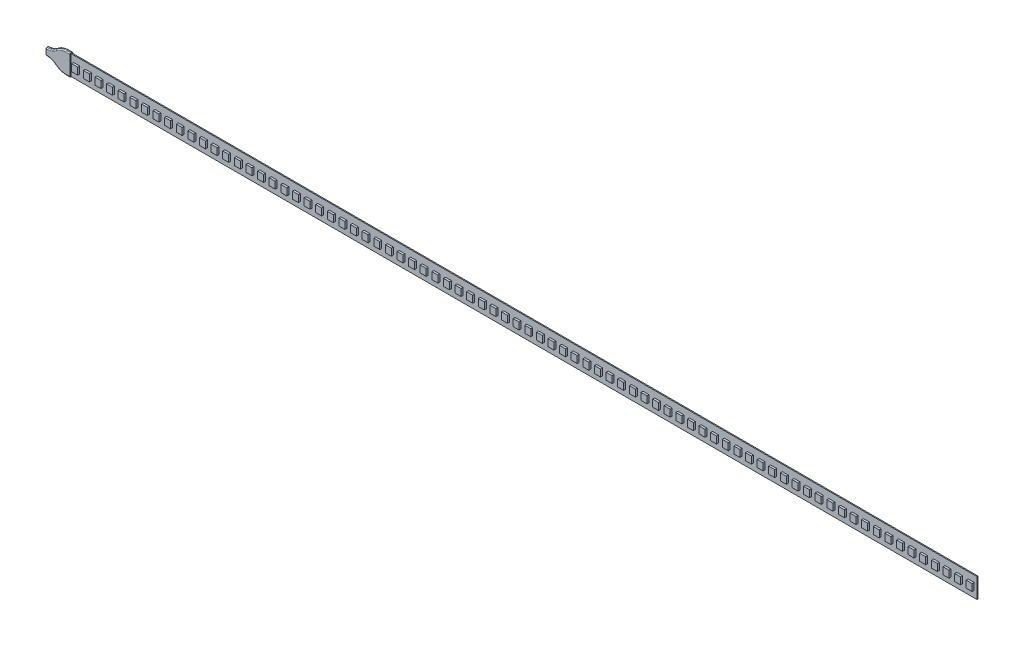
from build123d import *

# Parameters (mm, degrees)
SKETCH1_W                  = 35
SKETCH1_H                  = 10
BOSS_EXTRUDE1_DEPTH        = 0.5
SKETCH2_W                  = 3
SKETCH2_H                  = 3.5
BOSS_EXTRUDE2_DEPTH        = 1
LPATTERN1_COUNT            = 6
LPATTERN1_PITCH            = 5.833
LPATTERN2_COUNT            = 13
LPATTERN2_PITCH            = 35
LPATTERN2_COPY_1_SKETCH_W  = 3
LPATTERN2_COPY_1_SKETCH_H  = 3.5
LPATTERN2_COPY_1_DEPTH     = 1
LPATTERN2_COPY_2_SKETCH_W  = 3
LPATTERN2_COPY_2_SKETCH_H  = 3.5
LPATTERN2_COPY_2_DEPTH     = 1
LPATTERN2_COPY_3_SKETCH_W  = 3
LPATTERN2_COPY_3_SKETCH_H  = 3.5
LPATTERN2_COPY_3_DEPTH     = 1
LPATTERN2_COPY_4_SKETCH_W  = 3
LPATTERN2_COPY_4_SKETCH_H  = 3.5
LPATTERN2_COPY_4_DEPTH     = 1
LPATTERN2_COPY_5_SKETCH_W  = 3
LPATTERN2_COPY_5_SKETCH_H  = 3.5
LPATTERN2_COPY_5_DEPTH     = 1
LPATTERN2_COPY_6_SKETCH_W  = 3
LPATTERN2_COPY_6_SKETCH_H  = 3.5
LPATTERN2_COPY_6_DEPTH     = 1
LPATTERN2_COPY_7_SKETCH_W  = 3
LPATTERN2_COPY_7_SKETCH_H  = 3.5
LPATTERN2_COPY_7_DEPTH     = 1
LPATTERN2_COPY_8_SKETCH_W  = 3
LPATTERN2_COPY_8_SKETCH_H  = 3.5
LPATTERN2_COPY_8_DEPTH     = 1
LPATTERN2_COPY_9_SKETCH_W  = 3
LPATTERN2_COPY_9_SKETCH_H  = 3.5
LPATTERN2_COPY_9_DEPTH     = 1
LPATTERN2_COPY_10_SKETCH_W = 3
LPATTERN2_COPY_10_SKETCH_H = 3.5
LPATTERN2_COPY_10_DEPTH    = 1
LPATTERN2_COPY_11_SKETCH_W = 3
LPATTERN2_COPY_11_SKETCH_H = 3.5
LPATTERN2_COPY_11_DEPTH    = 1
LPATTERN2_COPY_12_SKETCH_W = 3
LPATTERN2_COPY_12_SKETCH_H = 3.5
LPATTERN2_COPY_12_DEPTH    = 1
LPATTERN2_COPY_13_SKETCH_W = 3
LPATTERN2_COPY_13_SKETCH_H = 3.5
LPATTERN2_COPY_13_DEPTH    = 1
LPATTERN2_COPY_14_SKETCH_W = 3
LPATTERN2_COPY_14_SKETCH_H = 3.5
LPATTERN2_COPY_14_DEPTH    = 1
LPATTERN2_COPY_15_SKETCH_W = 3
LPATTERN2_COPY_15_SKETCH_H = 3.5
LPATTERN2_COPY_15_DEPTH    = 1
LPATTERN2_COPY_16_SKETCH_W = 3
LPATTERN2_COPY_16_SKETCH_H = 3.5
LPATTERN2_COPY_16_DEPTH    = 1
LPATTERN2_COPY_17_SKETCH_W = 3
LPATTERN2_COPY_17_SKETCH_H = 3.5
LPATTERN2_COPY_17_DEPTH    = 1
LPATTERN2_COPY_18_SKETCH_W = 3
LPATTERN2_COPY_18_SKETCH_H = 3.5
LPATTERN2_COPY_18_DEPTH    = 1
LPATTERN2_COPY_19_SKETCH_W = 3
LPATTERN2_COPY_19_SKETCH_H = 3.5
LPATTERN2_COPY_19_DEPTH    = 1
LPATTERN2_COPY_20_SKETCH_W = 3
LPATTERN2_COPY_20_SKETCH_H = 3.5
LPATTERN2_COPY_20_DEPTH    = 1
LPATTERN2_COPY_21_SKETCH_W = 3
LPATTERN2_COPY_21_SKETCH_H = 3.5
LPATTERN2_COPY_21_DEPTH    = 1
LPATTERN2_COPY_22_SKETCH_W = 3
LPATTERN2_COPY_22_SKETCH_H = 3.5
LPATTERN2_COPY_22_DEPTH    = 1
LPATTERN2_COPY_23_SKETCH_W = 3
LPATTERN2_COPY_23_SKETCH_H = 3.5
LPATTERN2_COPY_23_DEPTH    = 1
LPATTERN2_COPY_24_SKETCH_W = 3
LPATTERN2_COPY_24_SKETCH_H = 3.5
LPATTERN2_COPY_24_DEPTH    = 1
LPATTERN2_COPY_25_SKETCH_W = 3
LPATTERN2_COPY_25_SKETCH_H = 3.5
LPATTERN2_COPY_25_DEPTH    = 1
LPATTERN2_COPY_26_SKETCH_W = 3
LPATTERN2_COPY_26_SKETCH_H = 3.5
LPATTERN2_COPY_26_DEPTH    = 1
LPATTERN2_COPY_27_SKETCH_W = 3
LPATTERN2_COPY_27_SKETCH_H = 3.5
LPATTERN2_COPY_27_DEPTH    = 1
LPATTERN2_COPY_28_SKETCH_W = 3
LPATTERN2_COPY_28_SKETCH_H = 3.5
LPATTERN2_COPY_28_DEPTH    = 1
LPATTERN2_COPY_29_SKETCH_W = 3
LPATTERN2_COPY_29_SKETCH_H = 3.5
LPATTERN2_COPY_29_DEPTH    = 1
LPATTERN2_COPY_30_SKETCH_W = 3
LPATTERN2_COPY_30_SKETCH_H = 3.5
LPATTERN2_COPY_30_DEPTH    = 1
LPATTERN2_COPY_31_SKETCH_W = 3
LPATTERN2_COPY_31_SKETCH_H = 3.5
LPATTERN2_COPY_31_DEPTH    = 1
LPATTERN2_COPY_32_SKETCH_W = 3
LPATTERN2_COPY_32_SKETCH_H = 3.5
LPATTERN2_COPY_32_DEPTH    = 1
LPATTERN2_COPY_33_SKETCH_W = 3
LPATTERN2_COPY_33_SKETCH_H = 3.5
LPATTERN2_COPY_33_DEPTH    = 1
LPATTERN2_COPY_34_SKETCH_W = 3
LPATTERN2_COPY_34_SKETCH_H = 3.5
LPATTERN2_COPY_34_DEPTH    = 1
LPATTERN2_COPY_35_SKETCH_W = 3
LPATTERN2_COPY_35_SKETCH_H = 3.5
LPATTERN2_COPY_35_DEPTH    = 1
LPATTERN2_COPY_36_SKETCH_W = 3
LPATTERN2_COPY_36_SKETCH_H = 3.5
LPATTERN2_COPY_36_DEPTH    = 1
LPATTERN2_COPY_37_SKETCH_W = 3
LPATTERN2_COPY_37_SKETCH_H = 3.5
LPATTERN2_COPY_37_DEPTH    = 1
LPATTERN2_COPY_38_SKETCH_W = 3
LPATTERN2_COPY_38_SKETCH_H = 3.5
LPATTERN2_COPY_38_DEPTH    = 1
LPATTERN2_COPY_39_SKETCH_W = 3
LPATTERN2_COPY_39_SKETCH_H = 3.5
LPATTERN2_COPY_39_DEPTH    = 1
LPATTERN2_COPY_40_SKETCH_W = 3
LPATTERN2_COPY_40_SKETCH_H = 3.5
LPATTERN2_COPY_40_DEPTH    = 1
LPATTERN2_COPY_41_SKETCH_W = 3
LPATTERN2_COPY_41_SKETCH_H = 3.5
LPATTERN2_COPY_41_DEPTH    = 1
LPATTERN2_COPY_42_SKETCH_W = 3
LPATTERN2_COPY_42_SKETCH_H = 3.5
LPATTERN2_COPY_42_DEPTH    = 1
LPATTERN2_COPY_43_SKETCH_W = 3
LPATTERN2_COPY_43_SKETCH_H = 3.5
LPATTERN2_COPY_43_DEPTH    = 1
LPATTERN2_COPY_44_SKETCH_W = 3
LPATTERN2_COPY_44_SKETCH_H = 3.5
LPATTERN2_COPY_44_DEPTH    = 1
LPATTERN2_COPY_45_SKETCH_W = 3
LPATTERN2_COPY_45_SKETCH_H = 3.5
LPATTERN2_COPY_45_DEPTH    = 1
LPATTERN2_COPY_46_SKETCH_W = 3
LPATTERN2_COPY_46_SKETCH_H = 3.5
LPATTERN2_COPY_46_DEPTH    = 1
LPATTERN2_COPY_47_SKETCH_W = 3
LPATTERN2_COPY_47_SKETCH_H = 3.5
LPATTERN2_COPY_47_DEPTH    = 1
LPATTERN2_COPY_48_SKETCH_W = 3
LPATTERN2_COPY_48_SKETCH_H = 3.5
LPATTERN2_COPY_48_DEPTH    = 1
LPATTERN2_COPY_49_SKETCH_W = 3
LPATTERN2_COPY_49_SKETCH_H = 3.5
LPATTERN2_COPY_49_DEPTH    = 1
LPATTERN2_COPY_50_SKETCH_W = 3
LPATTERN2_COPY_50_SKETCH_H = 3.5
LPATTERN2_COPY_50_DEPTH    = 1
LPATTERN2_COPY_51_SKETCH_W = 3
LPATTERN2_COPY_51_SKETCH_H = 3.5
LPATTERN2_COPY_51_DEPTH    = 1
LPATTERN2_COPY_52_SKETCH_W = 3
LPATTERN2_COPY_52_SKETCH_H = 3.5
LPATTERN2_COPY_52_DEPTH    = 1
LPATTERN2_COPY_53_SKETCH_W = 3
LPATTERN2_COPY_53_SKETCH_H = 3.5
LPATTERN2_COPY_53_DEPTH    = 1
LPATTERN2_COPY_54_SKETCH_W = 3
LPATTERN2_COPY_54_SKETCH_H = 3.5
LPATTERN2_COPY_54_DEPTH    = 1
LPATTERN2_COPY_55_SKETCH_W = 3
LPATTERN2_COPY_55_SKETCH_H = 3.5
LPATTERN2_COPY_55_DEPTH    = 1
LPATTERN2_COPY_56_SKETCH_W = 3
LPATTERN2_COPY_56_SKETCH_H = 3.5
LPATTERN2_COPY_56_DEPTH    = 1
LPATTERN2_COPY_57_SKETCH_W = 3
LPATTERN2_COPY_57_SKETCH_H = 3.5
LPATTERN2_COPY_57_DEPTH    = 1
LPATTERN2_COPY_58_SKETCH_W = 3
LPATTERN2_COPY_58_SKETCH_H = 3.5
LPATTERN2_COPY_58_DEPTH    = 1
LPATTERN2_COPY_59_SKETCH_W = 3
LPATTERN2_COPY_59_SKETCH_H = 3.5
LPATTERN2_COPY_59_DEPTH    = 1
LPATTERN2_COPY_60_SKETCH_W = 3
LPATTERN2_COPY_60_SKETCH_H = 3.5
LPATTERN2_COPY_60_DEPTH    = 1
BOSS_EXTRUDE3_DEPTH        = 1
BOSS_EXTRUDE3_DEPTH_BACK   = 0.5
FILLET1_R                  = 0.5


with BuildPart() as part:
    # Sketch1 → Boss-Extrude1 (new body)
    with BuildSketch(Plane.XY):
        Rectangle(SKETCH1_W, SKETCH1_H)
    boss_extrude1 = extrude(amount=BOSS_EXTRUDE1_DEPTH)

    # Sketch2 → Boss-Extrude2 (add)
    with BuildSketch(Plane.XY.offset(0.5)):
        with Locations((-14.5835, 0)):
            Rectangle(SKETCH2_W, SKETCH2_H)
    boss_extrude2 = extrude(amount=BOSS_EXTRUDE2_DEPTH)

    # LPattern1: Boss-Extrude2 ×6
    with Locations(*[(i * LPATTERN1_PITCH, 0, 0) for i in range(1, LPATTERN1_COUNT)]):
        add(boss_extrude2)

    # LPattern2: Boss-Extrude1, Boss-Extrude2 ×13
    with Locations(*[(i * LPATTERN2_PITCH, 0, 0) for i in range(1, LPATTERN2_COUNT)]):
        add(boss_extrude1)
        add(boss_extrude2)

    # LPattern2 copy 1 sketch → LPattern2 copy 1 (add)
    with BuildSketch(Plane(origin=(40.833, 0, 0.5), x_dir=(1, 0, 0), z_dir=(0, 0, 1))):
        with Locations((-14.5835, 0)):
            Rectangle(LPATTERN2_COPY_1_SKETCH_W, LPATTERN2_COPY_1_SKETCH_H)
    extrude(amount=LPATTERN2_COPY_1_DEPTH)

    # LPattern2 copy 2 sketch → LPattern2 copy 2 (add)
    with BuildSketch(Plane(origin=(75.833, 0, 0.5), x_dir=(1, 0, 0), z_dir=(0, 0, 1))):
        with Locations((-14.5835, 0)):
            Rectangle(LPATTERN2_COPY_2_SKETCH_W, LPATTERN2_COPY_2_SKETCH_H)
    extrude(amount=LPATTERN2_COPY_2_DEPTH)

    # LPattern2 copy 3 sketch → LPattern2 copy 3 (add)
    with BuildSketch(Plane(origin=(110.833, 0, 0.5), x_dir=(1, 0, 0), z_dir=(0, 0, 1))):
        with Locations((-14.5835, 0)):
            Rectangle(LPATTERN2_COPY_3_SKETCH_W, LPATTERN2_COPY_3_SKETCH_H)
    extrude(amount=LPATTERN2_COPY_3_DEPTH)

    # LPattern2 copy 4 sketch → LPattern2 copy 4 (add)
    with BuildSketch(Plane(origin=(145.833, 0, 0.5), x_dir=(1, 0, 0), z_dir=(0, 0, 1))):
        with Locations((-14.5835, 0)):
            Rectangle(LPATTERN2_COPY_4_SKETCH_W, LPATTERN2_COPY_4_SKETCH_H)
    extrude(amount=LPATTERN2_COPY_4_DEPTH)

    # LPattern2 copy 5 sketch → LPattern2 copy 5 (add)
    with BuildSketch(Plane(origin=(180.833, 0, 0.5), x_dir=(1, 0, 0), z_dir=(0, 0, 1))):
        with Locations((-14.5835, 0)):
            Rectangle(LPATTERN2_COPY_5_SKETCH_W, LPATTERN2_COPY_5_SKETCH_H)
    extrude(amount=LPATTERN2_COPY_5_DEPTH)

    # LPattern2 copy 6 sketch → LPattern2 copy 6 (add)
    with BuildSketch(Plane(origin=(215.833, 0, 0.5), x_dir=(1, 0, 0), z_dir=(0, 0, 1))):
        with Locations((-14.5835, 0)):
            Rectangle(LPATTERN2_COPY_6_SKETCH_W, LPATTERN2_COPY_6_SKETCH_H)
    extrude(amount=LPATTERN2_COPY_6_DEPTH)

    # LPattern2 copy 7 sketch → LPattern2 copy 7 (add)
    with BuildSketch(Plane(origin=(250.833, 0, 0.5), x_dir=(1, 0, 0), z_dir=(0, 0, 1))):
        with Locations((-14.5835, 0)):
            Rectangle(LPATTERN2_COPY_7_SKETCH_W, LPATTERN2_COPY_7_SKETCH_H)
    extrude(amount=LPATTERN2_COPY_7_DEPTH)

    # LPattern2 copy 8 sketch → LPattern2 copy 8 (add)
    with BuildSketch(Plane(origin=(285.833, 0, 0.5), x_dir=(1, 0, 0), z_dir=(0, 0, 1))):
        with Locations((-14.5835, 0)):
            Rectangle(LPATTERN2_COPY_8_SKETCH_W, LPATTERN2_COPY_8_SKETCH_H)
    extrude(amount=LPATTERN2_COPY_8_DEPTH)

    # LPattern2 copy 9 sketch → LPattern2 copy 9 (add)
    with BuildSketch(Plane(origin=(320.833, 0, 0.5), x_dir=(1, 0, 0), z_dir=(0, 0, 1))):
        with Locations((-14.5835, 0)):
            Rectangle(LPATTERN2_COPY_9_SKETCH_W, LPATTERN2_COPY_9_SKETCH_H)
    extrude(amount=LPATTERN2_COPY_9_DEPTH)

    # LPattern2 copy 10 sketch → LPattern2 copy 10 (add)
    with BuildSketch(Plane(origin=(355.833, 0, 0.5), x_dir=(1, 0, 0), z_dir=(0, 0, 1))):
        with Locations((-14.5835, 0)):
            Rectangle(LPATTERN2_COPY_10_SKETCH_W, LPATTERN2_COPY_10_SKETCH_H)
    extrude(amount=LPATTERN2_COPY_10_DEPTH)

    # LPattern2 copy 11 sketch → LPattern2 copy 11 (add)
    with BuildSketch(Plane(origin=(390.833, 0, 0.5), x_dir=(1, 0, 0), z_dir=(0, 0, 1))):
        with Locations((-14.5835, 0)):
            Rectangle(LPATTERN2_COPY_11_SKETCH_W, LPATTERN2_COPY_11_SKETCH_H)
    extrude(amount=LPATTERN2_COPY_11_DEPTH)

    # LPattern2 copy 12 sketch → LPattern2 copy 12 (add)
    with BuildSketch(Plane(origin=(425.833, 0, 0.5), x_dir=(1, 0, 0), z_dir=(0, 0, 1))):
        with Locations((-14.5835, 0)):
            Rectangle(LPATTERN2_COPY_12_SKETCH_W, LPATTERN2_COPY_12_SKETCH_H)
    extrude(amount=LPATTERN2_COPY_12_DEPTH)

    # LPattern2 copy 13 sketch → LPattern2 copy 13 (add)
    with BuildSketch(Plane(origin=(46.666, 0, 0.5), x_dir=(1, 0, 0), z_dir=(0, 0, 1))):
        with Locations((-14.5835, 0)):
            Rectangle(LPATTERN2_COPY_13_SKETCH_W, LPATTERN2_COPY_13_SKETCH_H)
    extrude(amount=LPATTERN2_COPY_13_DEPTH)

    # LPattern2 copy 14 sketch → LPattern2 copy 14 (add)
    with BuildSketch(Plane(origin=(81.666, 0, 0.5), x_dir=(1, 0, 0), z_dir=(0, 0, 1))):
        with Locations((-14.5835, 0)):
            Rectangle(LPATTERN2_COPY_14_SKETCH_W, LPATTERN2_COPY_14_SKETCH_H)
    extrude(amount=LPATTERN2_COPY_14_DEPTH)

    # LPattern2 copy 15 sketch → LPattern2 copy 15 (add)
    with BuildSketch(Plane(origin=(116.666, 0, 0.5), x_dir=(1, 0, 0), z_dir=(0, 0, 1))):
        with Locations((-14.5835, 0)):
            Rectangle(LPATTERN2_COPY_15_SKETCH_W, LPATTERN2_COPY_15_SKETCH_H)
    extrude(amount=LPATTERN2_COPY_15_DEPTH)

    # LPattern2 copy 16 sketch → LPattern2 copy 16 (add)
    with BuildSketch(Plane(origin=(151.666, 0, 0.5), x_dir=(1, 0, 0), z_dir=(0, 0, 1))):
        with Locations((-14.5835, 0)):
            Rectangle(LPATTERN2_COPY_16_SKETCH_W, LPATTERN2_COPY_16_SKETCH_H)
    extrude(amount=LPATTERN2_COPY_16_DEPTH)

    # LPattern2 copy 17 sketch → LPattern2 copy 17 (add)
    with BuildSketch(Plane(origin=(186.666, 0, 0.5), x_dir=(1, 0, 0), z_dir=(0, 0, 1))):
        with Locations((-14.5835, 0)):
            Rectangle(LPATTERN2_COPY_17_SKETCH_W, LPATTERN2_COPY_17_SKETCH_H)
    extrude(amount=LPATTERN2_COPY_17_DEPTH)

    # LPattern2 copy 18 sketch → LPattern2 copy 18 (add)
    with BuildSketch(Plane(origin=(221.666, 0, 0.5), x_dir=(1, 0, 0), z_dir=(0, 0, 1))):
        with Locations((-14.5835, 0)):
            Rectangle(LPATTERN2_COPY_18_SKETCH_W, LPATTERN2_COPY_18_SKETCH_H)
    extrude(amount=LPATTERN2_COPY_18_DEPTH)

    # LPattern2 copy 19 sketch → LPattern2 copy 19 (add)
    with BuildSketch(Plane(origin=(256.666, 0, 0.5), x_dir=(1, 0, 0), z_dir=(0, 0, 1))):
        with Locations((-14.5835, 0)):
            Rectangle(LPATTERN2_COPY_19_SKETCH_W, LPATTERN2_COPY_19_SKETCH_H)
    extrude(amount=LPATTERN2_COPY_19_DEPTH)

    # LPattern2 copy 20 sketch → LPattern2 copy 20 (add)
    with BuildSketch(Plane(origin=(291.666, 0, 0.5), x_dir=(1, 0, 0), z_dir=(0, 0, 1))):
        with Locations((-14.5835, 0)):
            Rectangle(LPATTERN2_COPY_20_SKETCH_W, LPATTERN2_COPY_20_SKETCH_H)
    extrude(amount=LPATTERN2_COPY_20_DEPTH)

    # LPattern2 copy 21 sketch → LPattern2 copy 21 (add)
    with BuildSketch(Plane(origin=(326.666, 0, 0.5), x_dir=(1, 0, 0), z_dir=(0, 0, 1))):
        with Locations((-14.5835, 0)):
            Rectangle(LPATTERN2_COPY_21_SKETCH_W, LPATTERN2_COPY_21_SKETCH_H)
    extrude(amount=LPATTERN2_COPY_21_DEPTH)

    # LPattern2 copy 22 sketch → LPattern2 copy 22 (add)
    with BuildSketch(Plane(origin=(361.666, 0, 0.5), x_dir=(1, 0, 0), z_dir=(0, 0, 1))):
        with Locations((-14.5835, 0)):
            Rectangle(LPATTERN2_COPY_22_SKETCH_W, LPATTERN2_COPY_22_SKETCH_H)
    extrude(amount=LPATTERN2_COPY_22_DEPTH)

    # LPattern2 copy 23 sketch → LPattern2 copy 23 (add)
    with BuildSketch(Plane(origin=(396.666, 0, 0.5), x_dir=(1, 0, 0), z_dir=(0, 0, 1))):
        with Locations((-14.5835, 0)):
            Rectangle(LPATTERN2_COPY_23_SKETCH_W, LPATTERN2_COPY_23_SKETCH_H)
    extrude(amount=LPATTERN2_COPY_23_DEPTH)

    # LPattern2 copy 24 sketch → LPattern2 copy 24 (add)
    with BuildSketch(Plane(origin=(431.666, 0, 0.5), x_dir=(1, 0, 0), z_dir=(0, 0, 1))):
        with Locations((-14.5835, 0)):
            Rectangle(LPATTERN2_COPY_24_SKETCH_W, LPATTERN2_COPY_24_SKETCH_H)
    extrude(amount=LPATTERN2_COPY_24_DEPTH)

    # LPattern2 copy 25 sketch → LPattern2 copy 25 (add)
    with BuildSketch(Plane(origin=(52.499, 0, 0.5), x_dir=(1, 0, 0), z_dir=(0, 0, 1))):
        with Locations((-14.5835, 0)):
            Rectangle(LPATTERN2_COPY_25_SKETCH_W, LPATTERN2_COPY_25_SKETCH_H)
    extrude(amount=LPATTERN2_COPY_25_DEPTH)

    # LPattern2 copy 26 sketch → LPattern2 copy 26 (add)
    with BuildSketch(Plane(origin=(87.499, 0, 0.5), x_dir=(1, 0, 0), z_dir=(0, 0, 1))):
        with Locations((-14.5835, 0)):
            Rectangle(LPATTERN2_COPY_26_SKETCH_W, LPATTERN2_COPY_26_SKETCH_H)
    extrude(amount=LPATTERN2_COPY_26_DEPTH)

    # LPattern2 copy 27 sketch → LPattern2 copy 27 (add)
    with BuildSketch(Plane(origin=(122.499, 0, 0.5), x_dir=(1, 0, 0), z_dir=(0, 0, 1))):
        with Locations((-14.5835, 0)):
            Rectangle(LPATTERN2_COPY_27_SKETCH_W, LPATTERN2_COPY_27_SKETCH_H)
    extrude(amount=LPATTERN2_COPY_27_DEPTH)

    # LPattern2 copy 28 sketch → LPattern2 copy 28 (add)
    with BuildSketch(Plane(origin=(157.499, 0, 0.5), x_dir=(1, 0, 0), z_dir=(0, 0, 1))):
        with Locations((-14.5835, 0)):
            Rectangle(LPATTERN2_COPY_28_SKETCH_W, LPATTERN2_COPY_28_SKETCH_H)
    extrude(amount=LPATTERN2_COPY_28_DEPTH)

    # LPattern2 copy 29 sketch → LPattern2 copy 29 (add)
    with BuildSketch(Plane(origin=(192.499, 0, 0.5), x_dir=(1, 0, 0), z_dir=(0, 0, 1))):
        with Locations((-14.5835, 0)):
            Rectangle(LPATTERN2_COPY_29_SKETCH_W, LPATTERN2_COPY_29_SKETCH_H)
    extrude(amount=LPATTERN2_COPY_29_DEPTH)

    # LPattern2 copy 30 sketch → LPattern2 copy 30 (add)
    with BuildSketch(Plane(origin=(227.499, 0, 0.5), x_dir=(1, 0, 0), z_dir=(0, 0, 1))):
        with Locations((-14.5835, 0)):
            Rectangle(LPATTERN2_COPY_30_SKETCH_W, LPATTERN2_COPY_30_SKETCH_H)
    extrude(amount=LPATTERN2_COPY_30_DEPTH)

    # LPattern2 copy 31 sketch → LPattern2 copy 31 (add)
    with BuildSketch(Plane(origin=(262.499, 0, 0.5), x_dir=(1, 0, 0), z_dir=(0, 0, 1))):
        with Locations((-14.5835, 0)):
            Rectangle(LPATTERN2_COPY_31_SKETCH_W, LPATTERN2_COPY_31_SKETCH_H)
    extrude(amount=LPATTERN2_COPY_31_DEPTH)

    # LPattern2 copy 32 sketch → LPattern2 copy 32 (add)
    with BuildSketch(Plane(origin=(297.499, 0, 0.5), x_dir=(1, 0, 0), z_dir=(0, 0, 1))):
        with Locations((-14.5835, 0)):
            Rectangle(LPATTERN2_COPY_32_SKETCH_W, LPATTERN2_COPY_32_SKETCH_H)
    extrude(amount=LPATTERN2_COPY_32_DEPTH)

    # LPattern2 copy 33 sketch → LPattern2 copy 33 (add)
    with BuildSketch(Plane(origin=(332.499, 0, 0.5), x_dir=(1, 0, 0), z_dir=(0, 0, 1))):
        with Locations((-14.5835, 0)):
            Rectangle(LPATTERN2_COPY_33_SKETCH_W, LPATTERN2_COPY_33_SKETCH_H)
    extrude(amount=LPATTERN2_COPY_33_DEPTH)

    # LPattern2 copy 34 sketch → LPattern2 copy 34 (add)
    with BuildSketch(Plane(origin=(367.499, 0, 0.5), x_dir=(1, 0, 0), z_dir=(0, 0, 1))):
        with Locations((-14.5835, 0)):
            Rectangle(LPATTERN2_COPY_34_SKETCH_W, LPATTERN2_COPY_34_SKETCH_H)
    extrude(amount=LPATTERN2_COPY_34_DEPTH)

    # LPattern2 copy 35 sketch → LPattern2 copy 35 (add)
    with BuildSketch(Plane(origin=(402.499, 0, 0.5), x_dir=(1, 0, 0), z_dir=(0, 0, 1))):
        with Locations((-14.5835, 0)):
            Rectangle(LPATTERN2_COPY_35_SKETCH_W, LPATTERN2_COPY_35_SKETCH_H)
    extrude(amount=LPATTERN2_COPY_35_DEPTH)

    # LPattern2 copy 36 sketch → LPattern2 copy 36 (add)
    with BuildSketch(Plane(origin=(437.499, 0, 0.5), x_dir=(1, 0, 0), z_dir=(0, 0, 1))):
        with Locations((-14.5835, 0)):
            Rectangle(LPATTERN2_COPY_36_SKETCH_W, LPATTERN2_COPY_36_SKETCH_H)
    extrude(amount=LPATTERN2_COPY_36_DEPTH)

    # LPattern2 copy 37 sketch → LPattern2 copy 37 (add)
    with BuildSketch(Plane(origin=(58.332, 0, 0.5), x_dir=(1, 0, 0), z_dir=(0, 0, 1))):
        with Locations((-14.5835, 0)):
            Rectangle(LPATTERN2_COPY_37_SKETCH_W, LPATTERN2_COPY_37_SKETCH_H)
    extrude(amount=LPATTERN2_COPY_37_DEPTH)

    # LPattern2 copy 38 sketch → LPattern2 copy 38 (add)
    with BuildSketch(Plane(origin=(93.332, 0, 0.5), x_dir=(1, 0, 0), z_dir=(0, 0, 1))):
        with Locations((-14.5835, 0)):
            Rectangle(LPATTERN2_COPY_38_SKETCH_W, LPATTERN2_COPY_38_SKETCH_H)
    extrude(amount=LPATTERN2_COPY_38_DEPTH)

    # LPattern2 copy 39 sketch → LPattern2 copy 39 (add)
    with BuildSketch(Plane(origin=(128.332, 0, 0.5), x_dir=(1, 0, 0), z_dir=(0, 0, 1))):
        with Locations((-14.5835, 0)):
            Rectangle(LPATTERN2_COPY_39_SKETCH_W, LPATTERN2_COPY_39_SKETCH_H)
    extrude(amount=LPATTERN2_COPY_39_DEPTH)

    # LPattern2 copy 40 sketch → LPattern2 copy 40 (add)
    with BuildSketch(Plane(origin=(163.332, 0, 0.5), x_dir=(1, 0, 0), z_dir=(0, 0, 1))):
        with Locations((-14.5835, 0)):
            Rectangle(LPATTERN2_COPY_40_SKETCH_W, LPATTERN2_COPY_40_SKETCH_H)
    extrude(amount=LPATTERN2_COPY_40_DEPTH)

    # LPattern2 copy 41 sketch → LPattern2 copy 41 (add)
    with BuildSketch(Plane(origin=(198.332, 0, 0.5), x_dir=(1, 0, 0), z_dir=(0, 0, 1))):
        with Locations((-14.5835, 0)):
            Rectangle(LPATTERN2_COPY_41_SKETCH_W, LPATTERN2_COPY_41_SKETCH_H)
    extrude(amount=LPATTERN2_COPY_41_DEPTH)

    # LPattern2 copy 42 sketch → LPattern2 copy 42 (add)
    with BuildSketch(Plane(origin=(233.332, 0, 0.5), x_dir=(1, 0, 0), z_dir=(0, 0, 1))):
        with Locations((-14.5835, 0)):
            Rectangle(LPATTERN2_COPY_42_SKETCH_W, LPATTERN2_COPY_42_SKETCH_H)
    extrude(amount=LPATTERN2_COPY_42_DEPTH)

    # LPattern2 copy 43 sketch → LPattern2 copy 43 (add)
    with BuildSketch(Plane(origin=(268.332, 0, 0.5), x_dir=(1, 0, 0), z_dir=(0, 0, 1))):
        with Locations((-14.5835, 0)):
            Rectangle(LPATTERN2_COPY_43_SKETCH_W, LPATTERN2_COPY_43_SKETCH_H)
    extrude(amount=LPATTERN2_COPY_43_DEPTH)

    # LPattern2 copy 44 sketch → LPattern2 copy 44 (add)
    with BuildSketch(Plane(origin=(303.332, 0, 0.5), x_dir=(1, 0, 0), z_dir=(0, 0, 1))):
        with Locations((-14.5835, 0)):
            Rectangle(LPATTERN2_COPY_44_SKETCH_W, LPATTERN2_COPY_44_SKETCH_H)
    extrude(amount=LPATTERN2_COPY_44_DEPTH)

    # LPattern2 copy 45 sketch → LPattern2 copy 45 (add)
    with BuildSketch(Plane(origin=(338.332, 0, 0.5), x_dir=(1, 0, 0), z_dir=(0, 0, 1))):
        with Locations((-14.5835, 0)):
            Rectangle(LPATTERN2_COPY_45_SKETCH_W, LPATTERN2_COPY_45_SKETCH_H)
    extrude(amount=LPATTERN2_COPY_45_DEPTH)

    # LPattern2 copy 46 sketch → LPattern2 copy 46 (add)
    with BuildSketch(Plane(origin=(373.332, 0, 0.5), x_dir=(1, 0, 0), z_dir=(0, 0, 1))):
        with Locations((-14.5835, 0)):
            Rectangle(LPATTERN2_COPY_46_SKETCH_W, LPATTERN2_COPY_46_SKETCH_H)
    extrude(amount=LPATTERN2_COPY_46_DEPTH)

    # LPattern2 copy 47 sketch → LPattern2 copy 47 (add)
    with BuildSketch(Plane(origin=(408.332, 0, 0.5), x_dir=(1, 0, 0), z_dir=(0, 0, 1))):
        with Locations((-14.5835, 0)):
            Rectangle(LPATTERN2_COPY_47_SKETCH_W, LPATTERN2_COPY_47_SKETCH_H)
    extrude(amount=LPATTERN2_COPY_47_DEPTH)

    # LPattern2 copy 48 sketch → LPattern2 copy 48 (add)
    with BuildSketch(Plane(origin=(443.332, 0, 0.5), x_dir=(1, 0, 0), z_dir=(0, 0, 1))):
        with Locations((-14.5835, 0)):
            Rectangle(LPATTERN2_COPY_48_SKETCH_W, LPATTERN2_COPY_48_SKETCH_H)
    extrude(amount=LPATTERN2_COPY_48_DEPTH)

    # LPattern2 copy 49 sketch → LPattern2 copy 49 (add)
    with BuildSketch(Plane(origin=(64.165, 0, 0.5), x_dir=(1, 0, 0), z_dir=(0, 0, 1))):
        with Locations((-14.5835, 0)):
            Rectangle(LPATTERN2_COPY_49_SKETCH_W, LPATTERN2_COPY_49_SKETCH_H)
    extrude(amount=LPATTERN2_COPY_49_DEPTH)

    # LPattern2 copy 50 sketch → LPattern2 copy 50 (add)
    with BuildSketch(Plane(origin=(99.165, 0, 0.5), x_dir=(1, 0, 0), z_dir=(0, 0, 1))):
        with Locations((-14.5835, 0)):
            Rectangle(LPATTERN2_COPY_50_SKETCH_W, LPATTERN2_COPY_50_SKETCH_H)
    extrude(amount=LPATTERN2_COPY_50_DEPTH)

    # LPattern2 copy 51 sketch → LPattern2 copy 51 (add)
    with BuildSketch(Plane(origin=(134.165, 0, 0.5), x_dir=(1, 0, 0), z_dir=(0, 0, 1))):
        with Locations((-14.5835, 0)):
            Rectangle(LPATTERN2_COPY_51_SKETCH_W, LPATTERN2_COPY_51_SKETCH_H)
    extrude(amount=LPATTERN2_COPY_51_DEPTH)

    # LPattern2 copy 52 sketch → LPattern2 copy 52 (add)
    with BuildSketch(Plane(origin=(169.165, 0, 0.5), x_dir=(1, 0, 0), z_dir=(0, 0, 1))):
        with Locations((-14.5835, 0)):
            Rectangle(LPATTERN2_COPY_52_SKETCH_W, LPATTERN2_COPY_52_SKETCH_H)
    extrude(amount=LPATTERN2_COPY_52_DEPTH)

    # LPattern2 copy 53 sketch → LPattern2 copy 53 (add)
    with BuildSketch(Plane(origin=(204.165, 0, 0.5), x_dir=(1, 0, 0), z_dir=(0, 0, 1))):
        with Locations((-14.5835, 0)):
            Rectangle(LPATTERN2_COPY_53_SKETCH_W, LPATTERN2_COPY_53_SKETCH_H)
    extrude(amount=LPATTERN2_COPY_53_DEPTH)

    # LPattern2 copy 54 sketch → LPattern2 copy 54 (add)
    with BuildSketch(Plane(origin=(239.165, 0, 0.5), x_dir=(1, 0, 0), z_dir=(0, 0, 1))):
        with Locations((-14.5835, 0)):
            Rectangle(LPATTERN2_COPY_54_SKETCH_W, LPATTERN2_COPY_54_SKETCH_H)
    extrude(amount=LPATTERN2_COPY_54_DEPTH)

    # LPattern2 copy 55 sketch → LPattern2 copy 55 (add)
    with BuildSketch(Plane(origin=(274.165, 0, 0.5), x_dir=(1, 0, 0), z_dir=(0, 0, 1))):
        with Locations((-14.5835, 0)):
            Rectangle(LPATTERN2_COPY_55_SKETCH_W, LPATTERN2_COPY_55_SKETCH_H)
    extrude(amount=LPATTERN2_COPY_55_DEPTH)

    # LPattern2 copy 56 sketch → LPattern2 copy 56 (add)
    with BuildSketch(Plane(origin=(309.165, 0, 0.5), x_dir=(1, 0, 0), z_dir=(0, 0, 1))):
        with Locations((-14.5835, 0)):
            Rectangle(LPATTERN2_COPY_56_SKETCH_W, LPATTERN2_COPY_56_SKETCH_H)
    extrude(amount=LPATTERN2_COPY_56_DEPTH)

    # LPattern2 copy 57 sketch → LPattern2 copy 57 (add)
    with BuildSketch(Plane(origin=(344.165, 0, 0.5), x_dir=(1, 0, 0), z_dir=(0, 0, 1))):
        with Locations((-14.5835, 0)):
            Rectangle(LPATTERN2_COPY_57_SKETCH_W, LPATTERN2_COPY_57_SKETCH_H)
    extrude(amount=LPATTERN2_COPY_57_DEPTH)

    # LPattern2 copy 58 sketch → LPattern2 copy 58 (add)
    with BuildSketch(Plane(origin=(379.165, 0, 0.5), x_dir=(1, 0, 0), z_dir=(0, 0, 1))):
        with Locations((-14.5835, 0)):
            Rectangle(LPATTERN2_COPY_58_SKETCH_W, LPATTERN2_COPY_58_SKETCH_H)
    extrude(amount=LPATTERN2_COPY_58_DEPTH)

    # LPattern2 copy 59 sketch → LPattern2 copy 59 (add)
    with BuildSketch(Plane(origin=(414.165, 0, 0.5), x_dir=(1, 0, 0), z_dir=(0, 0, 1))):
        with Locations((-14.5835, 0)):
            Rectangle(LPATTERN2_COPY_59_SKETCH_W, LPATTERN2_COPY_59_SKETCH_H)
    extrude(amount=LPATTERN2_COPY_59_DEPTH)

    # LPattern2 copy 60 sketch → LPattern2 copy 60 (add)
    with BuildSketch(Plane(origin=(449.165, 0, 0.5), x_dir=(1, 0, 0), z_dir=(0, 0, 1))):
        with Locations((-14.5835, 0)):
            Rectangle(LPATTERN2_COPY_60_SKETCH_W, LPATTERN2_COPY_60_SKETCH_H)
    extrude(amount=LPATTERN2_COPY_60_DEPTH)

    # Sketch3 → Boss-Extrude3 (add, two sides: drawn at the far end of the back side and taken through both)
    with BuildSketch(Plane.XY.offset(-BOSS_EXTRUDE3_DEPTH_BACK)):
        with BuildLine():
            Line((-17.5, 5.25), (-17.5, -5.25))
            Line((-17.5, -5.25), (-19.5, -5.25))
            ThreePointArc((-19.5, -5.25), (-22.148702513, -4.799864322), (-24.5, -3.5))
            ThreePointArc((-24.5, -3.5), (-26.851297487, -2.200135678), (-29.5, -1.75))
            Line((-29.5, -1.75), (-29.5, 1.75))
            ThreePointArc((-29.5, 1.75), (-26.851297487, 2.200135678), (-24.5, 3.5))
            ThreePointArc((-24.5, 3.5), (-22.148702513, 4.799864322), (-19.5, 5.25))
            Line((-19.5, 5.25), (-17.5, 5.25))
        make_face()
    extrude(amount=BOSS_EXTRUDE3_DEPTH + BOSS_EXTRUDE3_DEPTH_BACK)

    # Fillet1
    fillet1_edges = [part.edges().sort_by_distance(p)[0] for p in [
        (-18.5, -5.25, -0.5),
        (-22.148702513, -4.799864322, -0.5),
        (-26.851297487, -2.200135678, -0.5),
        (-26.851297487, 2.200135678, -0.5),
        (-22.148702513, 4.799864322, -0.5),
        (-18.5, 5.25, -0.5),
        (-18.5, -5.25, 1),
        (-18.5, 5.25, 1),
        (-22.148702513, 4.799864322, 1),
        (-26.851297487, 2.200135678, 1),
        (-26.851297487, -2.200135678, 1),
        (-22.148702513, -4.799864322, 1),
    ]]
    fillet(fillet1_edges, radius=FILLET1_R)


solid = part.part
